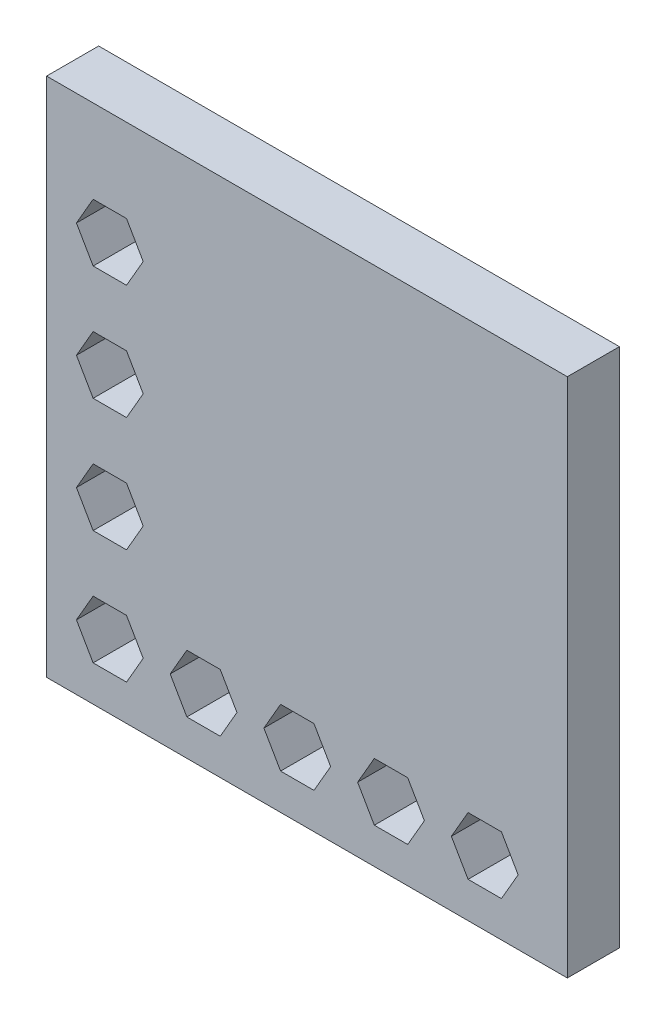
from build123d import *

# Parameters (mm, degrees)
SKETCH_1_W                 = 100
SKETCH_1_H                 = 100
EXTRUDE_1_DEPTH            = 10
CUT_EXTRUDE_2_DEPTH        = 142.774468788
PATTERN_LINEAR_1_COUNT     = 4
PATTERN_LINEAR_1_PITCH     = 22
PATTERN_LINEAR_1_COL_COUNT = 5
PATTERN_LINEAR_1_COL_PITCH = 18


with BuildPart() as part:
    # 草圖1 → 伸長1 (new body)
    with BuildSketch(Plane.XY):
        with Locations((50, 50)):
            Rectangle(SKETCH_1_W, SKETCH_1_H)
    extrude(amount=EXTRUDE_1_DEPTH)

    # 草圖2 → 伸長2 (cut, through all)
    with BuildSketch(Plane.XY.offset(10)):
        Polygon((15.34644344, 17.983526064), (8.935402707, 17.983526064), (5.72988234, 12.431401924), (8.935402707, 6.879277785), (15.34644344, 6.879277785), (18.551963806, 12.431401924), align=None)
    cut_extrude_2 = extrude(amount=-CUT_EXTRUDE_2_DEPTH, mode=Mode.SUBTRACT)

    # 直線複製排列1: 伸長2 ×4
    with Locations(*[(0, i * PATTERN_LINEAR_1_PITCH, 0) for i in range(1, PATTERN_LINEAR_1_COUNT)]):
        add(cut_extrude_2, mode=Mode.SUBTRACT)

    # 直線複製排列1 col: 伸長2 ×5
    with Locations(*[(i * PATTERN_LINEAR_1_COL_PITCH, 0, 0) for i in range(1, PATTERN_LINEAR_1_COL_COUNT)]):
        add(cut_extrude_2, mode=Mode.SUBTRACT)


solid = part.part
